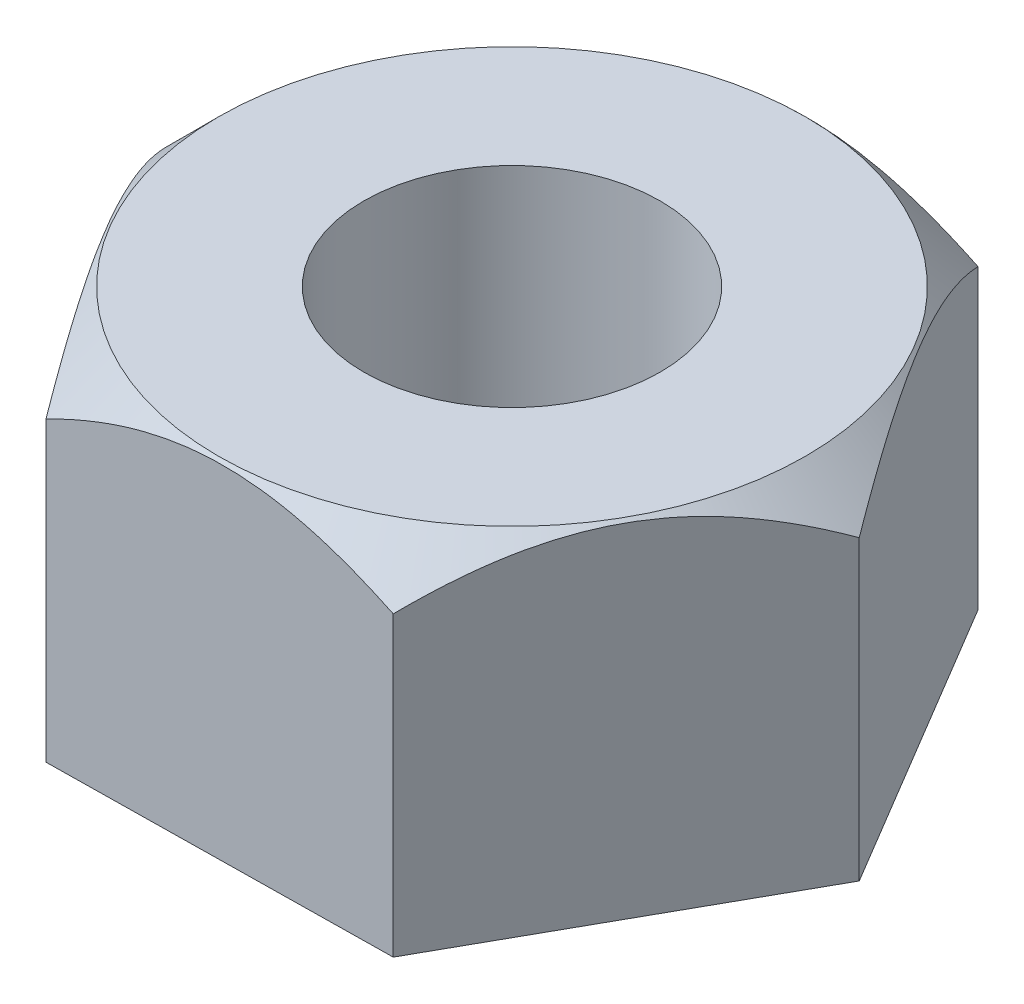
from build123d import *

# Parameters (mm, degrees)
BOSS_EXTRUDE1_DEPTH = 35
SKETCH2_R           = 15
CUT_EXTRUDE1_DEPTH  = 58.786414072
SKETCH6_OUTSIDE_W   = 110.956
SKETCH6_OUTSIDE_H   = 102.162
SKETCH6_OUTSIDE_R   = 29.714468975
CUT_EXTRUDE5_DEPTH  = 10
CUT_EXTRUDE5_DRAFT  = -45


with BuildPart() as part:
    # Sketch1 → Boss-Extrude1 (new body)
    with BuildSketch(Plane(origin=(0, 0, 0), x_dir=(1, 0, 0), z_dir=(0, 1, 0))):
        Polygon((17.741058042, -29.753232758), (34.637584434, 0.487590575), (16.896526392, 30.240823333), (-17.741058042, 29.753232758), (-34.637584434, -0.487590575), (-16.896526392, -30.240823333), align=None)
    extrude(amount=BOSS_EXTRUDE1_DEPTH)

    # Sketch2 → Cut-Extrude1 (cut, through all)
    with BuildSketch(Plane(origin=(0, 35, 0), x_dir=(1, 0, 0), z_dir=(0, 1, 0))):
        with Locations(Location((0, 0, 0), (0, 0, 270))):
            Circle(SKETCH2_R)
    extrude(amount=-CUT_EXTRUDE1_DEPTH, mode=Mode.SUBTRACT)


with BuildPart() as cut_extrude5_tool:
    # Sketch6 outside → Cut-Extrude5 (with draft: the straight prism first)
    with BuildSketch(Plane(origin=(0, 35, 0), x_dir=(1, 0, 0), z_dir=(0, 1, 0))):
        Rectangle(SKETCH6_OUTSIDE_W, SKETCH6_OUTSIDE_H)
        Circle(SKETCH6_OUTSIDE_R, mode=Mode.SUBTRACT)
    extrude(amount=-CUT_EXTRUDE5_DEPTH)
    # Cut-Extrude5: the draft: its side faces are tilted about the plane it starts from
    cut_extrude5_sides = [cut_extrude5_tool.faces().sort_by_distance(p)[0] for p in [
        (0, 30, 51.081),
        (55.478, 30, 0),
        (0, 30, -51.081),
        (-55.478, 30, 0),
        (-29.714468975, 30, 0),
    ]]
    draft(cut_extrude5_sides, Plane(origin=(0, 35, 0), x_dir=(1, 0, 0), z_dir=(0, 1, 0)), CUT_EXTRUDE5_DRAFT)


with BuildPart() as part_1:
    add(part.part)

    # Cut-Extrude5: cut by cut_extrude5_tool
    add(cut_extrude5_tool.part, mode=Mode.SUBTRACT)


solid = part_1.part
